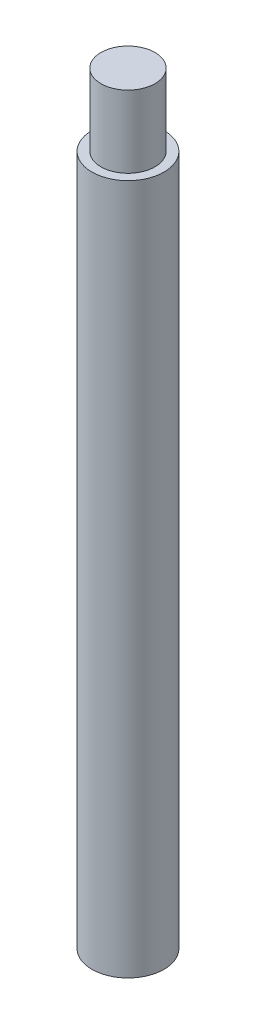
from build123d import *

# Parameters (mm, degrees)
SKETCH1_R           = 3
BOSS_EXTRUDE1_DEPTH = 57.5
SKETCH2_R           = 2.25
BOSS_EXTRUDE2_DEPTH = 6


with BuildPart() as part:
    # Sketch1 → Boss-Extrude1 (new body)
    with BuildSketch(Plane(origin=(0, 0, 0), x_dir=(1, 0, 0), z_dir=(0, 1, 0))):
        with Locations(Location((0, 0, 0), (0, 0, 270))):
            Circle(SKETCH1_R)
    extrude(amount=BOSS_EXTRUDE1_DEPTH)

    # Sketch2 → Boss-Extrude2 (add)
    with BuildSketch(Plane(origin=(0, 57.5, 0), x_dir=(1, 0, 0), z_dir=(0, 1, 0))):
        with Locations(Location((0, 0, 0), (0, 0, 270))):
            Circle(SKETCH2_R)
    extrude(amount=BOSS_EXTRUDE2_DEPTH)


solid = part.part
